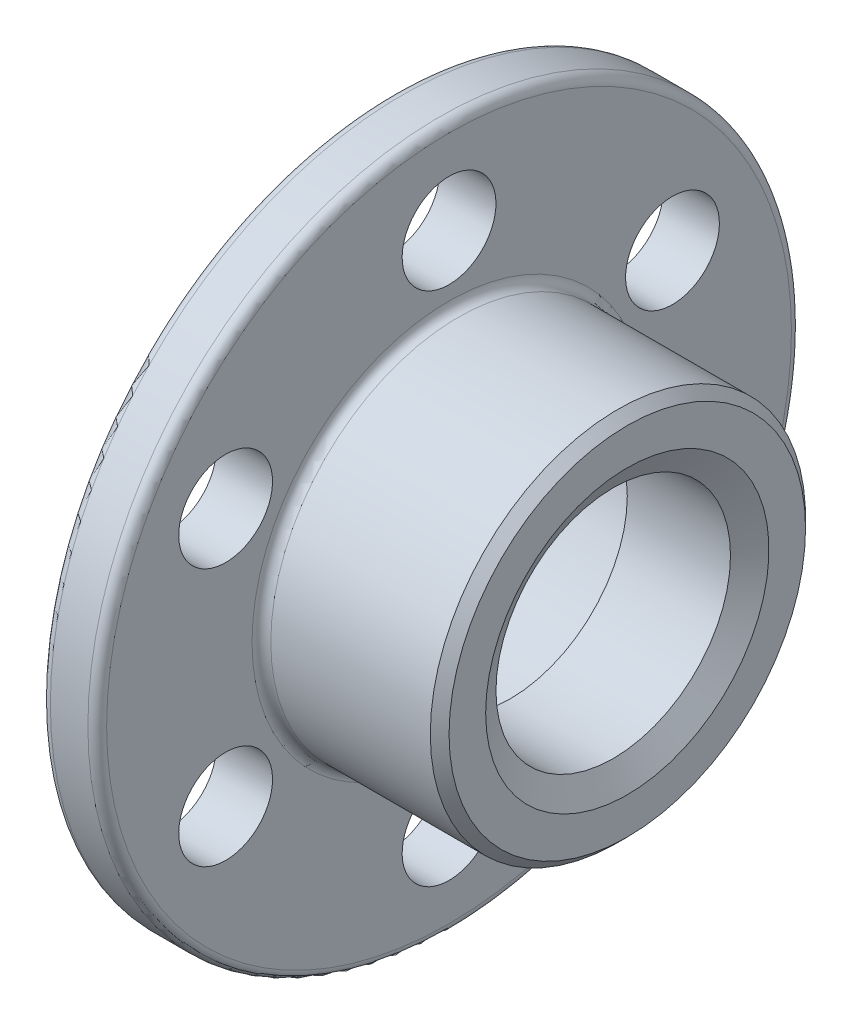
from build123d import *

# Parameters (mm, degrees)
SKETCH_2_W               = 12
SKETCH_2_H               = 10
PATTERN_CIRCULAR_1_COUNT = 6
FILLET_1_R               = 2
CHAMFER_1_SIZE           = 2
CHAMFER_3_SIZE           = 3
CHAMFER_3_SIZE2          = 5.196152423


with BuildPart() as part:
    # Эскиз1 → Повернуть1 (revolve)
    with BuildSketch(Plane.XY, mode=Mode.PRIVATE) as revolve_1_sk:
        Polygon((0, 35), (25, 35), (25, 25), (50, 25), (50, 40), (12, 40), (12, 75), (0, 75), align=None)
    revolve(revolve_1_sk.sketch.rotate(Axis((0, 0, 0), (1, 0, 0)), 90), axis=Axis((0, 0, 0), (1, 0, 0)))

    # Эскиз2 → Вырез-Повернуть1 (revolve, cut)
    with BuildSketch(Plane.XY, mode=Mode.PRIVATE) as cut_revolve_1_sk:
        with Locations((6, 60)):
            Rectangle(SKETCH_2_W, SKETCH_2_H)
    cut_revolve_1 = revolve(cut_revolve_1_sk.sketch.rotate(Axis((12, 55, 0), (1, 0, 0)), 180), axis=Axis((12, 55, 0), (1, 0, 0)), mode=Mode.SUBTRACT)

    # Круговой массив1: Вырез-Повернуть1 ×6 about axis
    pattern_circular_1_axis = Axis((0, 0, 0), (1, 0, 0))
    for i in range(1, PATTERN_CIRCULAR_1_COUNT):
        add(cut_revolve_1.rotate(pattern_circular_1_axis, i * 360 / PATTERN_CIRCULAR_1_COUNT), mode=Mode.SUBTRACT)

    # Скругление1
    fillet_1_edges = [part.edges().sort_by_distance(p)[0] for p in [
        (0, 0, -75),
        (12, 0, -75),
        (12, 0, -40),
    ]]
    fillet(fillet_1_edges, radius=FILLET_1_R)

    # Фаска1
    chamfer_1_edges = [part.edges().sort_by_distance(p)[0] for p in [
        (50, 0, -40),
    ]]
    chamfer(chamfer_1_edges, length=CHAMFER_1_SIZE)

    # Фаска3
    chamfer_3_edges = [part.edges().sort_by_distance(p)[0] for p in [
        (50, 0, -25),
    ]]
    chamfer_3_side = [part.faces().sort_by_distance(p)[0] for p in [
        (37.5, 0, -25),
    ]]
    chamfer(chamfer_3_edges, length=CHAMFER_3_SIZE, length2=CHAMFER_3_SIZE2, reference=chamfer_3_side[0])


solid = part.part
